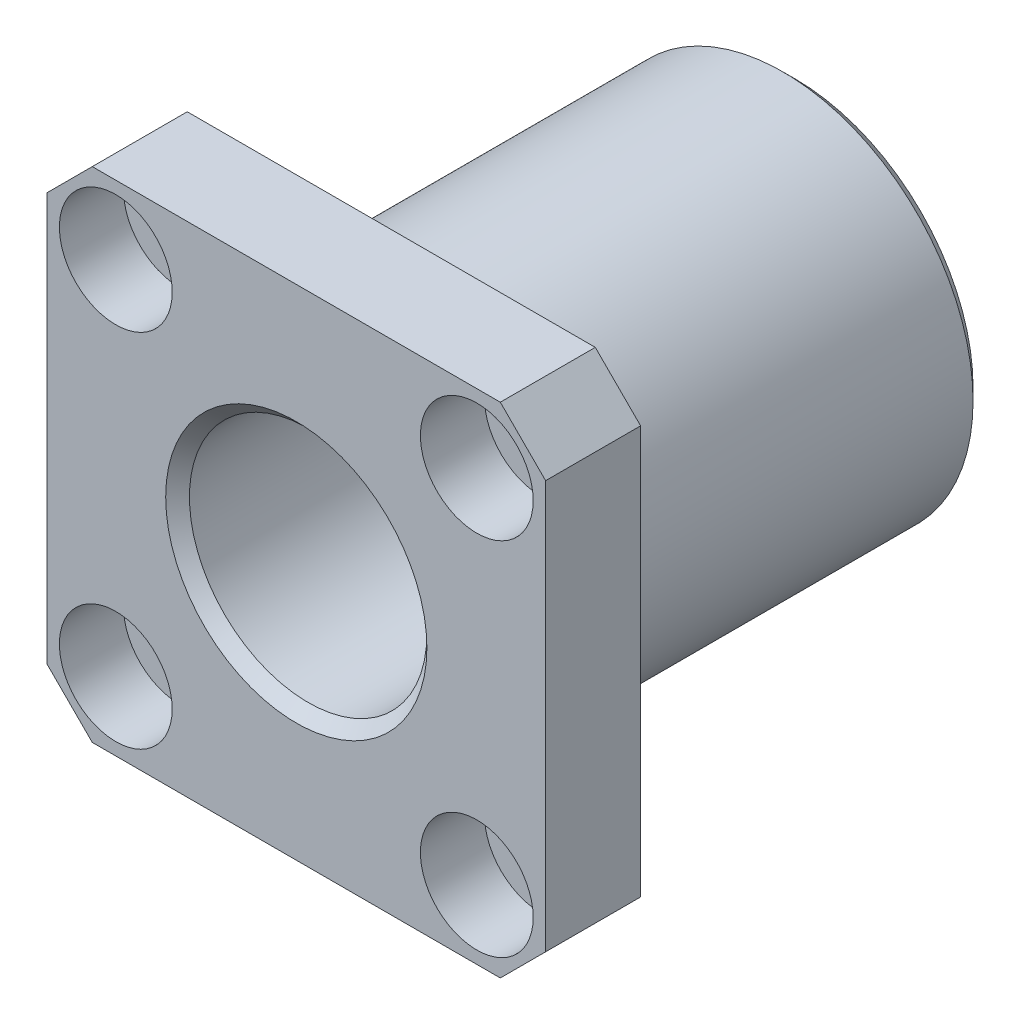
from build123d import *

# Parameters (mm, degrees)
SKETCH1_R                                           = 16
BOSS_EXTRUDE1_DEPTH                                 = 42
SKETCH2_W                                           = 42
SKETCH2_H                                           = 42
BOSS_EXTRUDE2_DEPTH                                 = 8
CUT_EXTRUDE1_DEPTH                                  = 52.439284598
CBORE_FOR_M5_HEX_SOCKET_HEAD_CAP_SCREW1_D           = 5.5
CBORE_FOR_M5_HEX_SOCKET_HEAD_CAP_SCREW1_DEPTH       = 22
CBORE_FOR_M5_HEX_SOCKET_HEAD_CAP_SCREW1_CBORE_D     = 9.5
CBORE_FOR_M5_HEX_SOCKET_HEAD_CAP_SCREW1_CBORE_DEPTH = 5.4
CBORE_FOR_M5_HEX_SOCKET_HEAD_CAP_SCREW1_TIP         = 1.652366702
SKETCH8_R                                           = 10
CUT_EXTRUDE2_DEPTH                                  = 52.439284598
CHAMFER1_SIZE                                       = 1


with BuildPart() as part:
    # Sketch1 → Boss-Extrude1 (new body)
    with BuildSketch(Plane.XY):
        with Locations(Location((0, 0, 0), (0, 0, 180))):
            Circle(SKETCH1_R)
    extrude(amount=BOSS_EXTRUDE1_DEPTH)

    # Sketch2 → Boss-Extrude2 (add)
    with BuildSketch(Plane.XY.offset(42)):
        Rectangle(SKETCH2_W, SKETCH2_H)
    extrude(amount=-BOSS_EXTRUDE2_DEPTH)

    # Sketch4 → Cut-Extrude1 (cut, through all)
    with BuildSketch(Plane.XY.offset(42)):
        Polygon((-21, 21), (-21, 17.183766184), (-17.183766184, 21), align=None)
        Polygon((17.183766184, 21), (21, 21), (21, 17.183766184), align=None)
        Polygon((21, -21), (21, -17.183766184), (17.183766184, -21), align=None)
        Polygon((-17.183766184, -21), (-21, -21), (-21, -17.183766184), align=None)
    extrude(amount=-CUT_EXTRUDE1_DEPTH, mode=Mode.SUBTRACT)

    # CBORE for M5 Hex Socket Head Cap Screw1
    with Locations(Plane.XY.offset(42)):
        with Locations((-15.202795796, 15.202795796), (15.202795796, 15.202795796), (15.202795796, -15.202795796), (-15.202795796, -15.202795796)):
            CounterBoreHole(CBORE_FOR_M5_HEX_SOCKET_HEAD_CAP_SCREW1_D / 2, CBORE_FOR_M5_HEX_SOCKET_HEAD_CAP_SCREW1_CBORE_D / 2, CBORE_FOR_M5_HEX_SOCKET_HEAD_CAP_SCREW1_CBORE_DEPTH, depth=CBORE_FOR_M5_HEX_SOCKET_HEAD_CAP_SCREW1_DEPTH)
            with Locations((0, 0, -(CBORE_FOR_M5_HEX_SOCKET_HEAD_CAP_SCREW1_DEPTH + CBORE_FOR_M5_HEX_SOCKET_HEAD_CAP_SCREW1_TIP / 2))):  # 118° drill point
                Cone(0, CBORE_FOR_M5_HEX_SOCKET_HEAD_CAP_SCREW1_D / 2, CBORE_FOR_M5_HEX_SOCKET_HEAD_CAP_SCREW1_TIP, mode=Mode.SUBTRACT)

    # Sketch8 → Cut-Extrude2 (cut, through all)
    with BuildSketch(Plane.XY.offset(42)):
        Circle(SKETCH8_R)
    extrude(amount=-CUT_EXTRUDE2_DEPTH, mode=Mode.SUBTRACT)

    # Chamfer1
    chamfer1_edges = [part.edges().sort_by_distance(p)[0] for p in [
        (-10, 0, 42),
        (16, 0, 0),
    ]]
    chamfer(chamfer1_edges, length=CHAMFER1_SIZE)


solid = part.part
